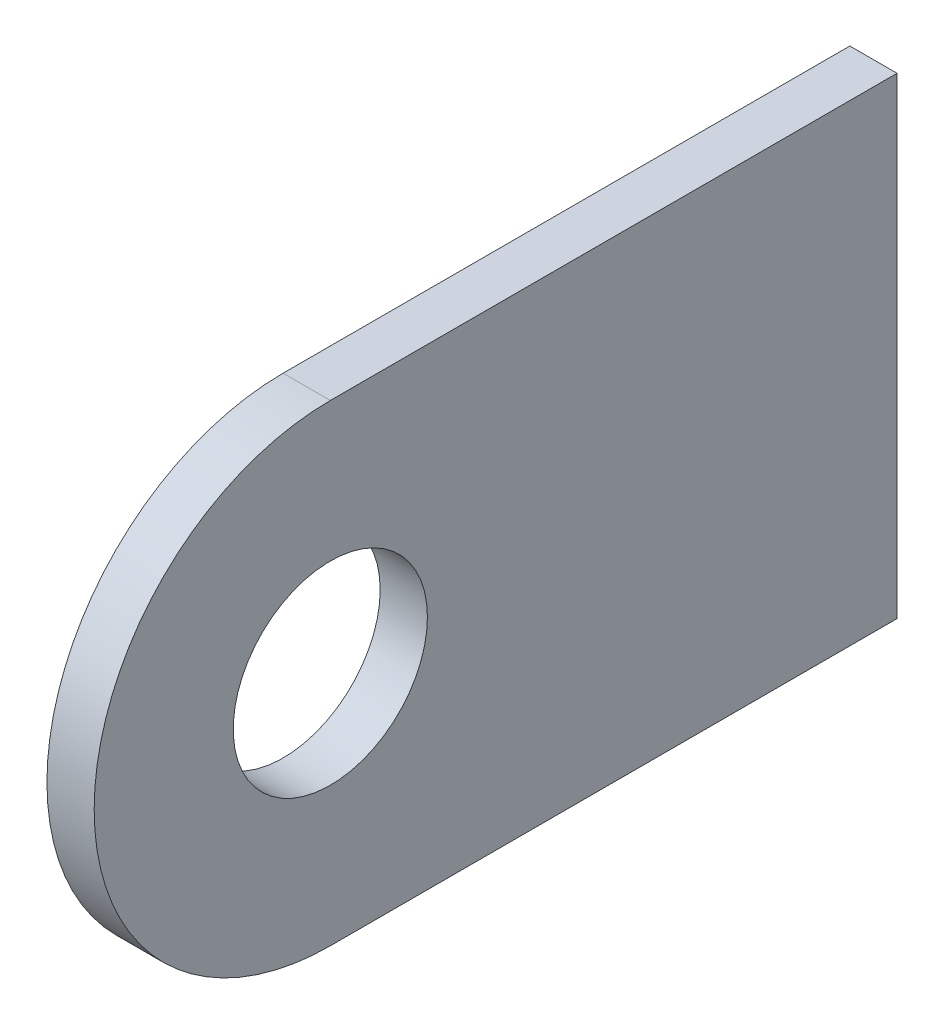
from build123d import *

# Parameters (mm, degrees)
BOSS_EXTRUDE1_DEPTH     = 1.5875
F_1_4_CLEARANCE_HOLE1_D = 6.5278


with BuildPart() as part:
    # Sketch1 → Boss-Extrude1 (new body)
    with BuildSketch(Plane(origin=(0, 0, 0), x_dir=(0, 0, -1), z_dir=(1, 0, 0))):
        with BuildLine():
            Line((0, -7.9375), (0, 7.9375))
            Line((0, 7.9375), (-19.05, 7.9375))
            ThreePointArc((-19.05, 7.9375), (-26.9875, 0), (-19.05, -7.9375))
            Line((-19.05, -7.9375), (0, -7.9375))
        make_face()
    extrude(amount=BOSS_EXTRUDE1_DEPTH)

    # 1/4 Clearance Hole1 (through all)
    with Locations(Plane(origin=(1.5875, 0, 0), x_dir=(0, 0, -1), z_dir=(1, 0, 0))):
        with Locations((-19.05, 0)):
            Hole(F_1_4_CLEARANCE_HOLE1_D / 2)


solid = part.part
